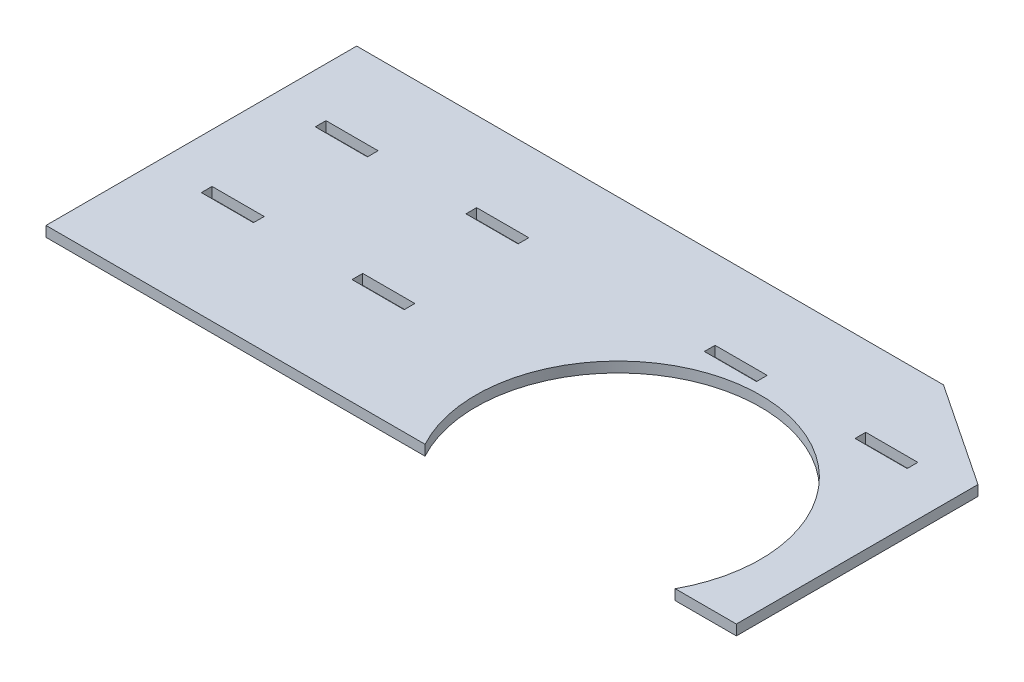
from build123d import *

# Parameters (mm, degrees)
SKETCH2_W           = 15.1
SKETCH2_H           = 3.1
BOSS_EXTRUDE2_DEPTH = 3


with BuildPart() as part:
    # Sketch2 → Boss-Extrude2 (new body)
    with BuildSketch(Plane(origin=(0, 0, 0), x_dir=(1, 0, 0), z_dir=(0, 1, 0))):
        with BuildLine():
            Line((0, 0), (109.814085495, 0))
            ThreePointArc((109.814085495, 0), (146.05, 60.93), (182.285914505, 0))
            Line((182.285914505, 0), (200, 0))
            Line((200, 0), (200, 70))
            Line((200, 70), (170, 90))
            Line((170, 90), (0, 90))
            Line((0, 90), (0, 0))
        make_face()
        with Locations((21.82, 32.29)):
            Rectangle(SKETCH2_W, SKETCH2_H, mode=Mode.SUBTRACT)
        with Locations((65.47, 32.29)):
            Rectangle(SKETCH2_W, SKETCH2_H, mode=Mode.SUBTRACT)
        with Locations((21.82, 65.29)):
            Rectangle(SKETCH2_W, SKETCH2_H, mode=Mode.SUBTRACT)
        with Locations((65.47, 65.29)):
            Rectangle(SKETCH2_W, SKETCH2_H, mode=Mode.SUBTRACT)
        with Locations((134.54, 65.29)):
            Rectangle(SKETCH2_W, SKETCH2_H, mode=Mode.SUBTRACT)
        with Locations((178.19, 65.29)):
            Rectangle(SKETCH2_W, SKETCH2_H, mode=Mode.SUBTRACT)
    extrude(amount=BOSS_EXTRUDE2_DEPTH)


solid = part.part
